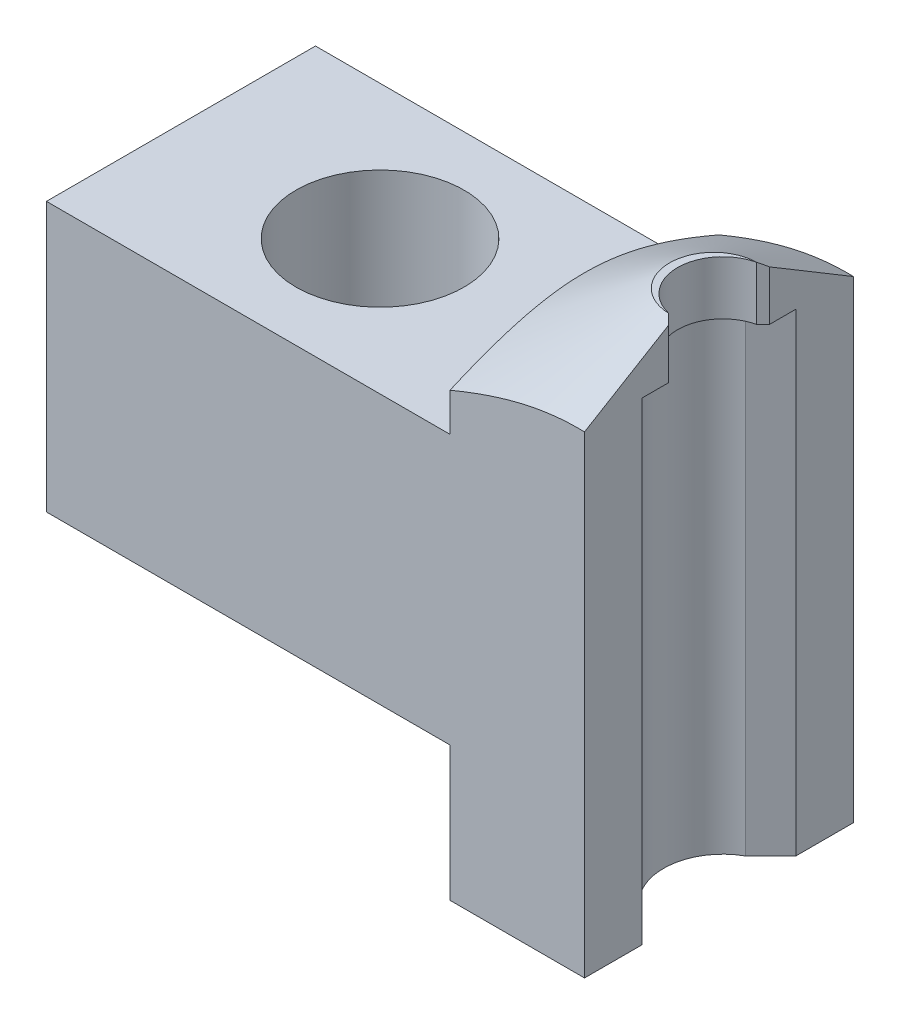
from build123d import *

# Parameters (mm, degrees)
SALIENTE_EXTRUIR1_DEPTH                              = 12.7
REFRENTADO_PARA_TORNILLO_CON_CABEZA_HUEC_D           = 5.1054
REFRENTADO_PARA_TORNILLO_CON_CABEZA_HUEC_CBORE_D     = 7.9375
REFRENTADO_PARA_TORNILLO_CON_CABEZA_HUEC_CBORE_DEPTH = 6.35
REFRENTADO_PARA_TORNILLO_CON_CABEZA_2_D              = 4.2672
REFRENTADO_PARA_TORNILLO_CON_CABEZA_2_CBORE_D        = 5.588
REFRENTADO_PARA_TORNILLO_CON_CABEZA_2_CBORE_DEPTH    = 22.352
CORTAR_EXTRUIR4_DEPTH                                = 22.352
CORTAR_EXTRUIR5_DEPTH                                = 33.139030617
CORTAR_EXTRUIR2_DEPTH                                = 6.35


with BuildPart() as part:
    # Croquis1 → Saliente-Extruir1 (new body)
    with BuildSketch(Plane.XY):
        Polygon((-9.525, 6.35), (-9.525, -6.35), (9.525, -6.35), (9.525, -12.7), (15.875, -12.7), (15.875, 12.192), (9.525, 12.192), (9.525, 6.35), align=None)
    extrude(amount=-SALIENTE_EXTRUIR1_DEPTH)

    # Refrentado para tornillo con cabeza huec (through all)
    with Locations(Plane(origin=(0, 6.35, 0), x_dir=(1, 0, 0), z_dir=(0, 1, 0))):
        with Locations((-0.127, 6.35)):
            CounterBoreHole(REFRENTADO_PARA_TORNILLO_CON_CABEZA_HUEC_D / 2, REFRENTADO_PARA_TORNILLO_CON_CABEZA_HUEC_CBORE_D / 2, REFRENTADO_PARA_TORNILLO_CON_CABEZA_HUEC_CBORE_DEPTH)

    # Refrentado para tornillo con cabeza  2 (through all)
    with Locations(Plane(origin=(0, -12.7, 0), x_dir=(-1, 0, 0), z_dir=(0, -1, 0))):
        with Locations((-16.0528, 6.35)):
            CounterBoreHole(REFRENTADO_PARA_TORNILLO_CON_CABEZA_2_D / 2, REFRENTADO_PARA_TORNILLO_CON_CABEZA_2_CBORE_D / 2, REFRENTADO_PARA_TORNILLO_CON_CABEZA_2_CBORE_DEPTH)

    # Croquis12 → Cortar-Extruir4 (cut)
    with BuildSketch(Plane.XZ.offset(12.7)):
        Polygon((15.875, -9.977962986), (14.6812, -8.784162986), (15.875, -8.784162986), align=None)
        Polygon((15.875, -3.915837014), (15.875, -2.722037014), (14.6812, -3.915837014), align=None)
    extrude(amount=-CORTAR_EXTRUIR4_DEPTH, mode=Mode.SUBTRACT)

    # Croquis13 → Cortar-Extruir5 (cut, through all)
    with BuildSketch(Plane.XZ.offset(12.7)):
        Polygon((15.875, -3.966896317), (15.5702, -4.271696317), (15.875, -4.271696317), align=None)
        Polygon((15.875, -8.428303683), (15.875, -8.733103683), (15.5702, -8.428303683), align=None)
    extrude(amount=-CORTAR_EXTRUIR5_DEPTH, mode=Mode.SUBTRACT)

    # Croquis21 → Cortar-Revolución12 (revolve, cut)
    with BuildSketch(Plane.XY.offset(-6.35)):
        Polygon((13.5382, 12.192), (5.6007, 7.422668836), (5.6007, 12.192), align=None)
    revolve(axis=Axis((15.621, 12.192, -6.35), (0, -1, 0)), mode=Mode.SUBTRACT)

    # Croquis5 → Cortar-Extruir2 (cut)
    with BuildSketch(Plane(origin=(15.875, 0, 0), x_dir=(0, 0, -1), z_dir=(1, 0, 0))):
        Polygon((8.472730115, 12.192), (12.7, 9.652), (12.7, 12.192), align=None)
        Polygon((4.227269885, 12.192), (0, 9.652), (0, 12.192), align=None)
    extrude(amount=-CORTAR_EXTRUIR2_DEPTH, mode=Mode.SUBTRACT)


solid = part.part
